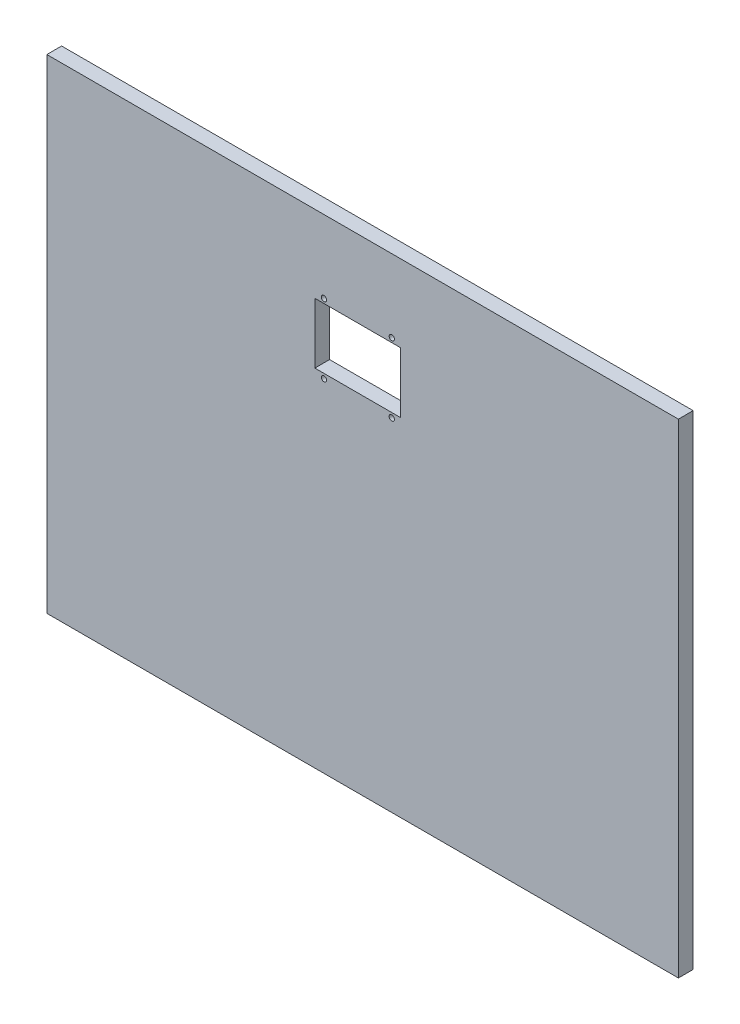
from build123d import *

# Parameters (mm, degrees)
SKETCH1_W           = 214
SKETCH1_H           = 164
SKETCH1_R           = 0.9
SKETCH1_W_2         = 29
SKETCH1_H_2         = 20.5
BOSS_EXTRUDE1_DEPTH = 5


with BuildPart() as part:
    # Sketch1 → Boss-Extrude1 (new body)
    with BuildSketch(Plane.XY):
        with Locations((107, 82)):
            Rectangle(SKETCH1_W, SKETCH1_H)
        with Locations((93.900938416, 139.347906795)):
            Circle(SKETCH1_R, mode=Mode.SUBTRACT)
        with Locations((116.881957079, 139.347906795)):
            Circle(SKETCH1_R, mode=Mode.SUBTRACT)
        with Locations((116.857391746, 115.791572104)):
            Circle(SKETCH1_R, mode=Mode.SUBTRACT)
        with Locations((93.900938416, 115.791572104)):
            Circle(SKETCH1_R, mode=Mode.SUBTRACT)
        with Locations((105.3099726, 127.633208092)):
            Rectangle(SKETCH1_W_2, SKETCH1_H_2, mode=Mode.SUBTRACT)
    extrude(amount=BOSS_EXTRUDE1_DEPTH)


solid = part.part
